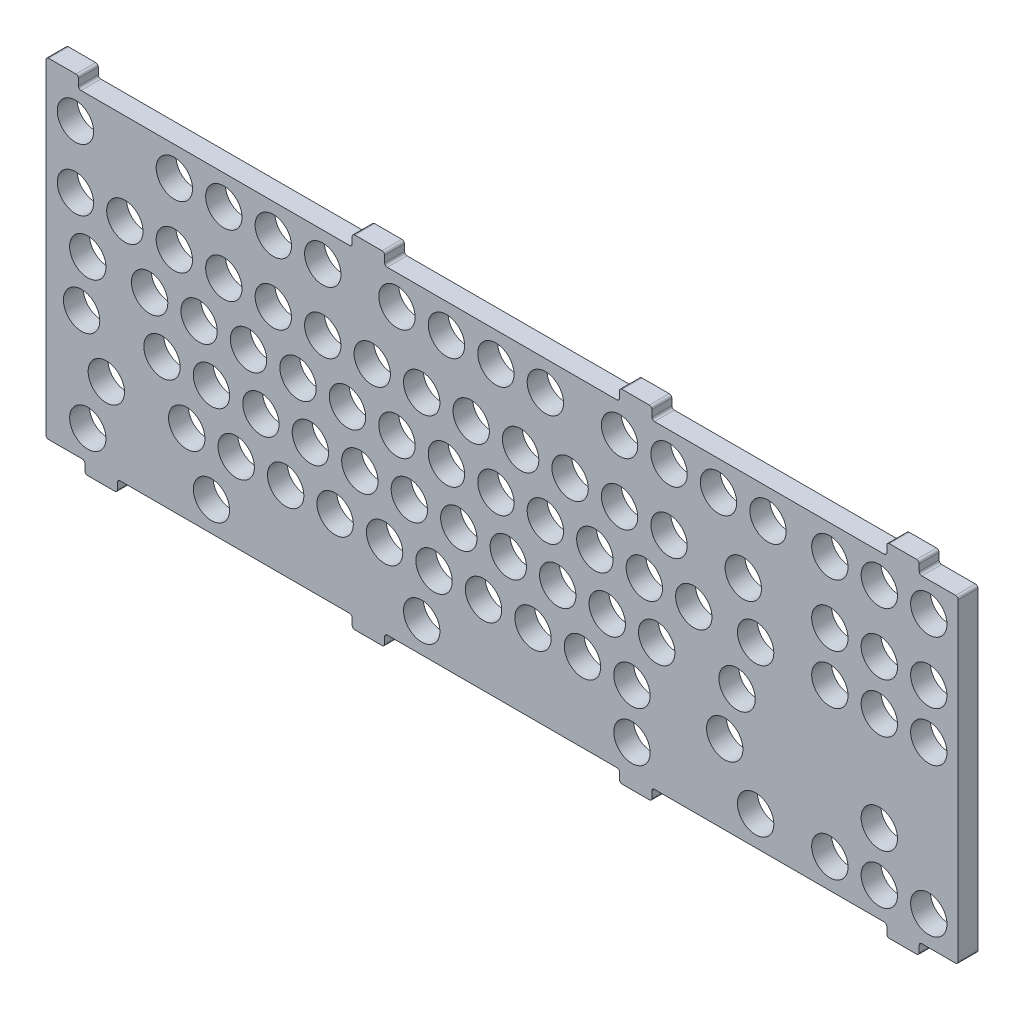
from build123d import *

# Parameters (mm, degrees)
BOSS_EXTRUDE1_DEPTH = 7.63


with BuildPart() as part:
    # Sketch1 → Boss-Extrude1 (new body)
    with BuildSketch(Plane.XY):
        with BuildLine():
            Line((-164.13125, 65.83125), (-174.63125, 65.83125))
            ThreePointArc((-174.63125, 65.83125), (-175.338356781, 65.538356781), (-175.63125, 64.83125))
            Line((-175.63125, 64.83125), (-175.63125, -60.33125))
            ThreePointArc((-175.63125, -60.33125), (-175.338356781, -61.038356781), (-174.63125, -61.33125))
            Line((-174.63125, -61.33125), (-161.631250002, -61.33125))
            ThreePointArc((-161.631250002, -61.33125), (-160.92414322, -61.624143219), (-160.631250002, -62.33125))
            Line((-160.631250002, -62.33125), (-160.631250002, -64.83125))
            ThreePointArc((-160.631250002, -64.83125), (-160.338356783, -65.538356781), (-159.631250002, -65.83125))
            Line((-159.631250002, -65.83125), (-149.131250002, -65.83125))
            ThreePointArc((-149.131250002, -65.83125), (-148.42414322, -65.538356781), (-148.131250002, -64.83125))
            Line((-148.131250002, -64.83125), (-148.131250002, -62.33125))
            ThreePointArc((-148.131250002, -62.33125), (-147.838356783, -61.624143219), (-147.131250002, -61.33125))
            Line((-147.131250002, -61.33125), (-58.710416668, -61.33125))
            ThreePointArc((-58.710416668, -61.33125), (-58.003309887, -61.624143219), (-57.710416668, -62.33125))
            Line((-57.710416668, -62.33125), (-57.710416668, -64.83125))
            ThreePointArc((-57.710416668, -64.83125), (-57.417523449, -65.538356781), (-56.710416668, -65.83125))
            Line((-56.710416668, -65.83125), (-46.210416668, -65.83125))
            ThreePointArc((-46.210416668, -65.83125), (-45.503309887, -65.538356781), (-45.210416668, -64.83125))
            Line((-45.210416668, -64.83125), (-45.210416668, -62.33125))
            ThreePointArc((-45.210416668, -62.33125), (-44.917523449, -61.624143219), (-44.210416668, -61.33125))
            Line((-44.210416668, -61.33125), (44.210416665, -61.33125))
            ThreePointArc((44.210416665, -61.33125), (44.917523446, -61.624143219), (45.210416665, -62.33125))
            Line((45.210416665, -62.33125), (45.210416665, -64.83125))
            ThreePointArc((45.210416665, -64.83125), (45.503309884, -65.538356781), (46.210416665, -65.83125))
            Line((46.210416665, -65.83125), (56.710416665, -65.83125))
            ThreePointArc((56.710416665, -65.83125), (57.417523446, -65.538356781), (57.710416665, -64.83125))
            Line((57.710416665, -64.83125), (57.710416665, -62.33125))
            ThreePointArc((57.710416665, -62.33125), (58.003309884, -61.624143219), (58.710416665, -61.33125))
            Line((58.710416665, -61.33125), (147.131249998, -61.33125))
            ThreePointArc((147.131249998, -61.33125), (147.83835678, -61.624143219), (148.131249998, -62.33125))
            Line((148.131249998, -62.33125), (148.131249998, -64.83125))
            ThreePointArc((148.131249998, -64.83125), (148.424143217, -65.538356781), (149.131249998, -65.83125))
            Line((149.131249998, -65.83125), (159.631249998, -65.83125))
            ThreePointArc((159.631249998, -65.83125), (160.33835678, -65.538356781), (160.631249998, -64.83125))
            Line((160.631249998, -64.83125), (160.631249998, -62.33125))
            ThreePointArc((160.631249998, -62.33125), (160.924143217, -61.624143219), (161.631249998, -61.33125))
            Line((161.631249998, -61.33125), (174.63125, -61.33125))
            ThreePointArc((174.63125, -61.33125), (175.338356781, -61.038356781), (175.63125, -60.33125))
            Line((175.63125, -60.33125), (175.63125, 60.33125))
            ThreePointArc((175.63125, 60.33125), (175.338356781, 61.038356781), (174.63125, 61.33125))
            Line((174.63125, 61.33125), (161.631249998, 61.33125))
            ThreePointArc((161.631249998, 61.33125), (160.924143217, 61.624143219), (160.631249998, 62.33125))
            Line((160.631249998, 62.33125), (160.631249998, 64.83125))
            ThreePointArc((160.631249998, 64.83125), (160.33835678, 65.538356781), (159.631249998, 65.83125))
            Line((159.631249998, 65.83125), (149.131249998, 65.83125))
            ThreePointArc((149.131249998, 65.83125), (148.424143217, 65.538356781), (148.131249998, 64.83125))
            Line((148.131249998, 64.83125), (148.131249998, 62.33125))
            ThreePointArc((148.131249998, 62.33125), (147.83835678, 61.624143219), (147.131249998, 61.33125))
            Line((147.131249998, 61.33125), (58.710416665, 61.33125))
            ThreePointArc((58.710416665, 61.33125), (58.003309884, 61.624143219), (57.710416665, 62.33125))
            Line((57.710416665, 62.33125), (57.710416665, 64.83125))
            ThreePointArc((57.710416665, 64.83125), (57.417523446, 65.538356781), (56.710416665, 65.83125))
            Line((56.710416665, 65.83125), (46.210416665, 65.83125))
            ThreePointArc((46.210416665, 65.83125), (45.503309884, 65.538356781), (45.210416665, 64.83125))
            Line((45.210416665, 64.83125), (45.210416665, 62.33125))
            ThreePointArc((45.210416665, 62.33125), (44.917523446, 61.624143219), (44.210416665, 61.33125))
            Line((44.210416665, 61.33125), (-44.210416668, 61.33125))
            ThreePointArc((-44.210416668, 61.33125), (-44.917523449, 61.624143219), (-45.210416668, 62.33125))
            Line((-45.210416668, 62.33125), (-45.210416668, 64.83125))
            ThreePointArc((-45.210416668, 64.83125), (-45.503309887, 65.538356781), (-46.210416668, 65.83125))
            Line((-46.210416668, 65.83125), (-56.710416668, 65.83125))
            ThreePointArc((-56.710416668, 65.83125), (-57.417523449, 65.538356781), (-57.710416668, 64.83125))
            Line((-57.710416668, 64.83125), (-57.710416668, 62.33125))
            ThreePointArc((-57.710416668, 62.33125), (-58.003309887, 61.624143219), (-58.710416668, 61.33125))
            Line((-58.710416668, 61.33125), (-162.13125, 61.33125))
            ThreePointArc((-162.13125, 61.33125), (-162.838356781, 61.624143219), (-163.13125, 62.33125))
            Line((-163.13125, 62.33125), (-163.13125, 64.83125))
            ThreePointArc((-163.13125, 64.83125), (-163.424143219, 65.538356781), (-164.13125, 65.83125))
        make_face()
        with BuildLine():
            ThreePointArc((11.906864998, -37.956179996), (18.907264998, -30.955779996), (11.906864998, -23.955379996))
            ThreePointArc((11.906864998, -23.955379996), (4.906464998, -30.955779996), (11.906864998, -37.956179996))
        make_face(mode=Mode.SUBTRACT)
        with BuildLine():
            ThreePointArc((50.006864998, -57.006159996), (57.007254998, -50.005769996), (50.006864998, -43.005379996))
            ThreePointArc((50.006864998, -43.005379996), (43.006474998, -50.005769996), (50.006864998, -57.006159996))
        make_face(mode=Mode.SUBTRACT)
        with BuildLine():
            ThreePointArc((40.481864998, -18.905979996), (47.482164998, -11.905679996), (40.481864998, -4.905379996))
            ThreePointArc((40.481864998, -4.905379996), (33.481564998, -11.905679996), (40.481864998, -18.905979996))
        make_face(mode=Mode.SUBTRACT)
        with BuildLine():
            ThreePointArc((2.381864998, -18.905979996), (9.382164998, -11.905679996), (2.381864998, -4.905379996))
            ThreePointArc((2.381864998, -4.905379996), (-4.618435002, -11.905679996), (2.381864998, -18.905979996))
        make_face(mode=Mode.SUBTRACT)
        with BuildLine():
            ThreePointArc((-35.719635002, -18.905979996), (-28.719335002, -11.905679996), (-35.719635002, -4.905379996))
            ThreePointArc((-35.719635002, -4.905379996), (-42.719935002, -11.905679996), (-35.719635002, -18.905979996))
        make_face(mode=Mode.SUBTRACT)
        with BuildLine():
            ThreePointArc((-45.243135002, -37.956179996), (-38.242735002, -30.955779996), (-45.243135002, -23.955379996))
            ThreePointArc((-45.243135002, -23.955379996), (-52.243535002, -30.955779996), (-45.243135002, -37.956179996))
        make_face(mode=Mode.SUBTRACT)
        with BuildLine():
            ThreePointArc((-54.769635002, -18.905979996), (-47.769335002, -11.905679996), (-54.769635002, -4.905379996))
            ThreePointArc((-54.769635002, -4.905379996), (-61.769935002, -11.905679996), (-54.769635002, -18.905979996))
        make_face(mode=Mode.SUBTRACT)
        with BuildLine():
            ThreePointArc((-64.294635002, -37.956179996), (-57.294235002, -30.955779996), (-64.294635002, -23.955379996))
            ThreePointArc((-64.294635002, -23.955379996), (-71.295035002, -30.955779996), (-64.294635002, -37.956179996))
        make_face(mode=Mode.SUBTRACT)
        with BuildLine():
            ThreePointArc((-102.393285002, -37.956179996), (-95.392885002, -30.955779996), (-102.393285002, -23.955379996))
            ThreePointArc((-102.393285002, -23.955379996), (-109.393685002, -30.955779996), (-102.393285002, -37.956179996))
        make_face(mode=Mode.SUBTRACT)
        with BuildLine():
            ThreePointArc((-111.919685002, -18.905979996), (-104.919385002, -11.905679996), (-111.919685002, -4.905379996))
            ThreePointArc((-111.919685002, -4.905379996), (-118.919985002, -11.905679996), (-111.919685002, -18.905979996))
        make_face(mode=Mode.SUBTRACT)
        with BuildLine():
            ThreePointArc((-121.443285002, -37.956179996), (-114.442885002, -30.955779996), (-121.443285002, -23.955379996))
            ThreePointArc((-121.443285002, -23.955379996), (-128.443685002, -30.955779996), (-121.443285002, -37.956179996))
        make_face(mode=Mode.SUBTRACT)
        with BuildLine():
            ThreePointArc((-159.543205002, -57.006159996), (-152.542815002, -50.005769996), (-159.543205002, -43.005379996))
            ThreePointArc((-159.543205002, -43.005379996), (-166.543595002, -50.005769996), (-159.543205002, -57.006159996))
        make_face(mode=Mode.SUBTRACT)
        with BuildLine():
            ThreePointArc((-161.925170002, -18.905979996), (-154.924870002, -11.905679996), (-161.925170002, -4.905379996))
            ThreePointArc((-161.925170002, -4.905379996), (-168.925470002, -11.905679996), (-161.925170002, -18.905979996))
        make_face(mode=Mode.SUBTRACT)
        with BuildLine():
            ThreePointArc((90.487864998, -18.905979996), (97.488164998, -11.905679996), (90.487864998, -4.905379996))
            ThreePointArc((90.487864998, -4.905379996), (83.487564998, -11.905679996), (90.487864998, -18.905979996))
        make_face(mode=Mode.SUBTRACT)
        with BuildLine():
            ThreePointArc((97.631864998, -57.006159996), (104.632254998, -50.005769996), (97.631864998, -43.005379996))
            ThreePointArc((97.631864998, -43.005379996), (90.631474998, -50.005769996), (97.631864998, -57.006159996))
        make_face(mode=Mode.SUBTRACT)
        with BuildLine():
            ThreePointArc((145.256864998, -37.956179996), (152.257264998, -30.955779996), (145.256864998, -23.955379996))
            ThreePointArc((145.256864998, -23.955379996), (138.256464998, -30.955779996), (145.256864998, -37.956179996))
        make_face(mode=Mode.SUBTRACT)
        with BuildLine():
            ThreePointArc((145.256864998, -57.006159996), (152.257254998, -50.005769996), (145.256864998, -43.005379996))
            ThreePointArc((145.256864998, -43.005379996), (138.256474998, -50.005769996), (145.256864998, -57.006159996))
        make_face(mode=Mode.SUBTRACT)
        with BuildLine():
            ThreePointArc((145.256864998, 0.144020004), (152.257164998, 7.144320004), (145.256864998, 14.144620004))
            ThreePointArc((145.256864998, 14.144620004), (138.256564998, 7.144320004), (145.256864998, 0.144020004))
        make_face(mode=Mode.SUBTRACT)
        with BuildLine():
            ThreePointArc((97.631864998, 0.144020004), (104.632164998, 7.144320004), (97.631864998, 14.144620004))
            ThreePointArc((97.631864998, 14.144620004), (90.631564998, 7.144320004), (97.631864998, 0.144020004))
        make_face(mode=Mode.SUBTRACT)
        with BuildLine():
            ThreePointArc((126.206864998, 19.194020004), (133.207164998, 26.194320004), (126.206864998, 33.194620004))
            ThreePointArc((126.206864998, 33.194620004), (119.206564998, 26.194320004), (126.206864998, 19.194020004))
        make_face(mode=Mode.SUBTRACT)
        with BuildLine():
            ThreePointArc((164.306864998, 19.194020004), (171.307164998, 26.194320004), (164.306864998, 33.194620004))
            ThreePointArc((164.306864998, 33.194620004), (157.306564998, 26.194320004), (164.306864998, 19.194020004))
        make_face(mode=Mode.SUBTRACT)
        with BuildLine():
            ThreePointArc((145.256864998, 43.006220004), (152.256864998, 50.006220004), (145.256864998, 57.006220004))
            ThreePointArc((145.256864998, 57.006220004), (138.256864998, 50.006220004), (145.256864998, 43.006220004))
        make_face(mode=Mode.SUBTRACT)
        with BuildLine():
            ThreePointArc((102.393364998, 43.006220004), (109.393364998, 50.006220004), (102.393364998, 57.006220004))
            ThreePointArc((102.393364998, 57.006220004), (95.393364998, 50.006220004), (102.393364998, 43.006220004))
        make_face(mode=Mode.SUBTRACT)
        with BuildLine():
            ThreePointArc((73.818364998, 0.144020004), (80.818664998, 7.144320004), (73.818364998, 14.144620004))
            ThreePointArc((73.818364998, 14.144620004), (66.818064998, 7.144320004), (73.818364998, 0.144020004))
        make_face(mode=Mode.SUBTRACT)
        with BuildLine():
            ThreePointArc((35.718364998, 0.131528429), (42.731156574, 7.144320004), (35.718364998, 14.157111579))
            ThreePointArc((35.718364998, 14.157111579), (28.705573423, 7.144320004), (35.718364998, 0.131528429))
        make_face(mode=Mode.SUBTRACT)
        with BuildLine():
            ThreePointArc((-2.381635002, 0.144020004), (4.618664998, 7.144320004), (-2.381635002, 14.144620004))
            ThreePointArc((-2.381635002, 14.144620004), (-9.381935002, 7.144320004), (-2.381635002, 0.144020004))
        make_face(mode=Mode.SUBTRACT)
        with BuildLine():
            ThreePointArc((26.193364998, 19.194020004), (33.193664998, 26.194320004), (26.193364998, 33.194620004))
            ThreePointArc((26.193364998, 33.194620004), (19.193064998, 26.194320004), (26.193364998, 19.194020004))
        make_face(mode=Mode.SUBTRACT)
        with BuildLine():
            ThreePointArc((64.293364998, 19.194020004), (71.293664998, 26.194320004), (64.293364998, 33.194620004))
            ThreePointArc((64.293364998, 33.194620004), (57.293064998, 26.194320004), (64.293364998, 19.194020004))
        make_face(mode=Mode.SUBTRACT)
        with BuildLine():
            ThreePointArc((45.243364998, 43.006220004), (52.243364998, 50.006220004), (45.243364998, 57.006220004))
            ThreePointArc((45.243364998, 57.006220004), (38.243364998, 50.006220004), (45.243364998, 43.006220004))
        make_face(mode=Mode.SUBTRACT)
        with BuildLine():
            ThreePointArc((-2.381635002, 43.006220004), (4.618364998, 50.006220004), (-2.381635002, 57.006220004))
            ThreePointArc((-2.381635002, 57.006220004), (-9.381635002, 50.006220004), (-2.381635002, 43.006220004))
        make_face(mode=Mode.SUBTRACT)
        with BuildLine():
            ThreePointArc((-159.543205002, 0.144020004), (-152.542905002, 7.144320004), (-159.543205002, 14.144620004))
            ThreePointArc((-159.543205002, 14.144620004), (-166.543505002, 7.144320004), (-159.543205002, 0.144020004))
        make_face(mode=Mode.SUBTRACT)
        with BuildLine():
            ThreePointArc((-21.431635002, 0.144020004), (-14.431335002, 7.144320004), (-21.431635002, 14.144620004))
            ThreePointArc((-21.431635002, 14.144620004), (-28.431935002, 7.144320004), (-21.431635002, 0.144020004))
        make_face(mode=Mode.SUBTRACT)
        with BuildLine():
            ThreePointArc((-59.531635002, 0.144020004), (-52.531335002, 7.144320004), (-59.531635002, 14.144620004))
            ThreePointArc((-59.531635002, 14.144620004), (-66.531935002, 7.144320004), (-59.531635002, 0.144020004))
        make_face(mode=Mode.SUBTRACT)
        with BuildLine():
            ThreePointArc((-97.631485002, 0.144020004), (-90.631185002, 7.144320004), (-97.631485002, 14.144620004))
            ThreePointArc((-97.631485002, 14.144620004), (-104.631785002, 7.144320004), (-97.631485002, 0.144020004))
        make_face(mode=Mode.SUBTRACT)
        with BuildLine():
            ThreePointArc((-135.731485002, 0.144020004), (-128.731185002, 7.144320004), (-135.731485002, 14.144620004))
            ThreePointArc((-135.731485002, 14.144620004), (-142.731785002, 7.144320004), (-135.731485002, 0.144020004))
        make_face(mode=Mode.SUBTRACT)
        with BuildLine():
            ThreePointArc((-50.006635002, 19.194020004), (-43.006335002, 26.194320004), (-50.006635002, 33.194620004))
            ThreePointArc((-50.006635002, 33.194620004), (-57.006935002, 26.194320004), (-50.006635002, 19.194020004))
        make_face(mode=Mode.SUBTRACT)
        with BuildLine():
            ThreePointArc((-88.106485002, 19.194020004), (-81.106185002, 26.194320004), (-88.106485002, 33.194620004))
            ThreePointArc((-88.106485002, 33.194620004), (-95.106785002, 26.194320004), (-88.106485002, 19.194020004))
        make_face(mode=Mode.SUBTRACT)
        with BuildLine():
            ThreePointArc((-126.206485002, 19.194020004), (-119.206185002, 26.194320004), (-126.206485002, 33.194620004))
            ThreePointArc((-126.206485002, 33.194620004), (-133.206785002, 26.194320004), (-126.206485002, 19.194020004))
        make_face(mode=Mode.SUBTRACT)
        with BuildLine():
            ThreePointArc((-21.431635002, 43.006220004), (-14.431635002, 50.006220004), (-21.431635002, 57.006220004))
            ThreePointArc((-21.431635002, 57.006220004), (-28.431635002, 50.006220004), (-21.431635002, 43.006220004))
        make_face(mode=Mode.SUBTRACT)
        with BuildLine():
            ThreePointArc((-69.056485002, 43.006220004), (-62.056485002, 50.006220004), (-69.056485002, 57.006220004))
            ThreePointArc((-69.056485002, 57.006220004), (-76.056485002, 50.006220004), (-69.056485002, 43.006220004))
        make_face(mode=Mode.SUBTRACT)
        with BuildLine():
            ThreePointArc((-107.156485002, 43.006220004), (-100.156485002, 50.006220004), (-107.156485002, 57.006220004))
            ThreePointArc((-107.156485002, 57.006220004), (-114.156485002, 50.006220004), (-107.156485002, 43.006220004))
        make_face(mode=Mode.SUBTRACT)
        with BuildLine():
            ThreePointArc((-164.306400002, 43.006220004), (-157.306400002, 50.006220004), (-164.306400002, 57.006220004))
            ThreePointArc((-164.306400002, 57.006220004), (-171.306400002, 50.006220004), (-164.306400002, 43.006220004))
        make_face(mode=Mode.SUBTRACT)
        with BuildLine():
            ThreePointArc((-126.206485002, 43.006220004), (-119.206485002, 50.006220004), (-126.206485002, 57.006220004))
            ThreePointArc((-126.206485002, 57.006220004), (-133.206485002, 50.006220004), (-126.206485002, 43.006220004))
        make_face(mode=Mode.SUBTRACT)
        with BuildLine():
            ThreePointArc((-88.106485002, 43.006220004), (-81.106485002, 50.006220004), (-88.106485002, 57.006220004))
            ThreePointArc((-88.106485002, 57.006220004), (-95.106485002, 50.006220004), (-88.106485002, 43.006220004))
        make_face(mode=Mode.SUBTRACT)
        with BuildLine():
            ThreePointArc((-40.481635002, 43.006220004), (-33.481635002, 50.006220004), (-40.481635002, 57.006220004))
            ThreePointArc((-40.481635002, 57.006220004), (-47.481635002, 50.006220004), (-40.481635002, 43.006220004))
        make_face(mode=Mode.SUBTRACT)
        with BuildLine():
            ThreePointArc((-145.256485002, 19.194020004), (-138.256185002, 26.194320004), (-145.256485002, 33.194620004))
            ThreePointArc((-145.256485002, 33.194620004), (-152.256785002, 26.194320004), (-145.256485002, 19.194020004))
        make_face(mode=Mode.SUBTRACT)
        with BuildLine():
            ThreePointArc((-107.156485002, 19.194020004), (-100.156185002, 26.194320004), (-107.156485002, 33.194620004))
            ThreePointArc((-107.156485002, 33.194620004), (-114.156785002, 26.194320004), (-107.156485002, 19.194020004))
        make_face(mode=Mode.SUBTRACT)
        with BuildLine():
            ThreePointArc((-69.056485002, 19.194020004), (-62.056185002, 26.194320004), (-69.056485002, 33.194620004))
            ThreePointArc((-69.056485002, 33.194620004), (-76.056785002, 26.194320004), (-69.056485002, 19.194020004))
        make_face(mode=Mode.SUBTRACT)
        with BuildLine():
            ThreePointArc((-30.956635002, 19.194020004), (-23.956335002, 26.194320004), (-30.956635002, 33.194620004))
            ThreePointArc((-30.956635002, 33.194620004), (-37.956935002, 26.194320004), (-30.956635002, 19.194020004))
        make_face(mode=Mode.SUBTRACT)
        with BuildLine():
            ThreePointArc((-116.681485002, 0.144020004), (-109.681185002, 7.144320004), (-116.681485002, 14.144620004))
            ThreePointArc((-116.681485002, 14.144620004), (-123.681785002, 7.144320004), (-116.681485002, 0.144020004))
        make_face(mode=Mode.SUBTRACT)
        with BuildLine():
            ThreePointArc((-78.581485002, 0.144020004), (-71.581185002, 7.144320004), (-78.581485002, 14.144620004))
            ThreePointArc((-78.581485002, 14.144620004), (-85.581785002, 7.144320004), (-78.581485002, 0.144020004))
        make_face(mode=Mode.SUBTRACT)
        with BuildLine():
            ThreePointArc((-40.481635002, 0.144020004), (-33.481335002, 7.144320004), (-40.481635002, 14.144620004))
            ThreePointArc((-40.481635002, 14.144620004), (-47.481935002, 7.144320004), (-40.481635002, 0.144020004))
        make_face(mode=Mode.SUBTRACT)
        with BuildLine():
            ThreePointArc((-164.306400002, 19.194020004), (-157.306100002, 26.194320004), (-164.306400002, 33.194620004))
            ThreePointArc((-164.306400002, 33.194620004), (-171.306700002, 26.194320004), (-164.306400002, 19.194020004))
        make_face(mode=Mode.SUBTRACT)
        with BuildLine():
            ThreePointArc((-11.906635002, 19.194020004), (-4.906335002, 26.194320004), (-11.906635002, 33.194620004))
            ThreePointArc((-11.906635002, 33.194620004), (-18.906935002, 26.194320004), (-11.906635002, 19.194020004))
        make_face(mode=Mode.SUBTRACT)
        with BuildLine():
            ThreePointArc((16.668364998, 43.006220004), (23.668364998, 50.006220004), (16.668364998, 57.006220004))
            ThreePointArc((16.668364998, 57.006220004), (9.668364998, 50.006220004), (16.668364998, 43.006220004))
        make_face(mode=Mode.SUBTRACT)
        with BuildLine():
            ThreePointArc((64.293364998, 43.006220004), (71.293364998, 50.006220004), (64.293364998, 57.006220004))
            ThreePointArc((64.293364998, 57.006220004), (57.293364998, 50.006220004), (64.293364998, 43.006220004))
        make_face(mode=Mode.SUBTRACT)
        with BuildLine():
            ThreePointArc((45.243364998, 19.194020004), (52.243664998, 26.194320004), (45.243364998, 33.194620004))
            ThreePointArc((45.243364998, 33.194620004), (38.243064998, 26.194320004), (45.243364998, 19.194020004))
        make_face(mode=Mode.SUBTRACT)
        with BuildLine():
            ThreePointArc((7.143364998, 19.194020004), (14.143664998, 26.194320004), (7.143364998, 33.194620004))
            ThreePointArc((7.143364998, 33.194620004), (0.143064998, 26.194320004), (7.143364998, 19.194020004))
        make_face(mode=Mode.SUBTRACT)
        with BuildLine():
            ThreePointArc((16.668364998, 0.144020004), (23.668664998, 7.144320004), (16.668364998, 14.144620004))
            ThreePointArc((16.668364998, 14.144620004), (9.668064998, 7.144320004), (16.668364998, 0.144020004))
        make_face(mode=Mode.SUBTRACT)
        with BuildLine():
            ThreePointArc((54.768364998, 0.144020004), (61.768664998, 7.144320004), (54.768364998, 14.144620004))
            ThreePointArc((54.768364998, 14.144620004), (47.768064998, 7.144320004), (54.768364998, 0.144020004))
        make_face(mode=Mode.SUBTRACT)
        with BuildLine():
            ThreePointArc((83.343364998, 43.006220004), (90.343364998, 50.006220004), (83.343364998, 57.006220004))
            ThreePointArc((83.343364998, 57.006220004), (76.343364998, 50.006220004), (83.343364998, 43.006220004))
        make_face(mode=Mode.SUBTRACT)
        with BuildLine():
            ThreePointArc((126.206864998, 43.006220004), (133.206864998, 50.006220004), (126.206864998, 57.006220004))
            ThreePointArc((126.206864998, 57.006220004), (119.206864998, 50.006220004), (126.206864998, 43.006220004))
        make_face(mode=Mode.SUBTRACT)
        with BuildLine():
            ThreePointArc((164.306864998, 43.006220004), (171.306864998, 50.006220004), (164.306864998, 57.006220004))
            ThreePointArc((164.306864998, 57.006220004), (157.306864998, 50.006220004), (164.306864998, 43.006220004))
        make_face(mode=Mode.SUBTRACT)
        with BuildLine():
            ThreePointArc((145.256864998, 19.194020004), (152.257164998, 26.194320004), (145.256864998, 33.194620004))
            ThreePointArc((145.256864998, 33.194620004), (138.256564998, 26.194320004), (145.256864998, 19.194020004))
        make_face(mode=Mode.SUBTRACT)
        with BuildLine():
            ThreePointArc((92.868364998, 19.194020004), (99.868664998, 26.194320004), (92.868364998, 33.194620004))
            ThreePointArc((92.868364998, 33.194620004), (85.868064998, 26.194320004), (92.868364998, 19.194020004))
        make_face(mode=Mode.SUBTRACT)
        with BuildLine():
            ThreePointArc((126.206864998, 0.144020004), (133.207164998, 7.144320004), (126.206864998, 14.144620004))
            ThreePointArc((126.206864998, 14.144620004), (119.206564998, 7.144320004), (126.206864998, 0.144020004))
        make_face(mode=Mode.SUBTRACT)
        with BuildLine():
            ThreePointArc((164.306864998, 0.144020004), (171.307164998, 7.144320004), (164.306864998, 14.144620004))
            ThreePointArc((164.306864998, 14.144620004), (157.306564998, 7.144320004), (164.306864998, 0.144020004))
        make_face(mode=Mode.SUBTRACT)
        with BuildLine():
            ThreePointArc((126.206864998, -57.006159996), (133.207254998, -50.005769996), (126.206864998, -43.005379996))
            ThreePointArc((126.206864998, -43.005379996), (119.206474998, -50.005769996), (126.206864998, -57.006159996))
        make_face(mode=Mode.SUBTRACT)
        with BuildLine():
            ThreePointArc((164.306864998, -57.006159996), (171.307254998, -50.005769996), (164.306864998, -43.005379996))
            ThreePointArc((164.306864998, -43.005379996), (157.306474998, -50.005769996), (164.306864998, -57.006159996))
        make_face(mode=Mode.SUBTRACT)
        with BuildLine():
            ThreePointArc((85.724864998, -37.956179996), (92.725264998, -30.955779996), (85.724864998, -23.955379996))
            ThreePointArc((85.724864998, -23.955379996), (78.724464998, -30.955779996), (85.724864998, -37.956179996))
        make_face(mode=Mode.SUBTRACT)
        with BuildLine():
            ThreePointArc((59.531864998, -18.905979996), (66.532164998, -11.905679996), (59.531864998, -4.905379996))
            ThreePointArc((59.531864998, -4.905379996), (52.531564998, -11.905679996), (59.531864998, -18.905979996))
        make_face(mode=Mode.SUBTRACT)
        with BuildLine():
            ThreePointArc((-130.969685002, -18.905979996), (-123.969385002, -11.905679996), (-130.969685002, -4.905379996))
            ThreePointArc((-130.969685002, -4.905379996), (-137.969985002, -11.905679996), (-130.969685002, -18.905979996))
        make_face(mode=Mode.SUBTRACT)
        with BuildLine():
            ThreePointArc((-152.400185002, -37.956179996), (-145.399785002, -30.955779996), (-152.400185002, -23.955379996))
            ThreePointArc((-152.400185002, -23.955379996), (-159.400585002, -30.955779996), (-152.400185002, -37.956179996))
        make_face(mode=Mode.SUBTRACT)
        with BuildLine():
            ThreePointArc((-111.918285002, -57.006159996), (-104.917895002, -50.005769996), (-111.918285002, -43.005379996))
            ThreePointArc((-111.918285002, -43.005379996), (-118.918675002, -50.005769996), (-111.918285002, -57.006159996))
        make_face(mode=Mode.SUBTRACT)
        with BuildLine():
            ThreePointArc((-92.869685002, -18.905979996), (-85.869385002, -11.905679996), (-92.869685002, -4.905379996))
            ThreePointArc((-92.869685002, -4.905379996), (-99.869985002, -11.905679996), (-92.869685002, -18.905979996))
        make_face(mode=Mode.SUBTRACT)
        with BuildLine():
            ThreePointArc((-83.344685002, -37.956179996), (-76.344285002, -30.955779996), (-83.344685002, -23.955379996))
            ThreePointArc((-83.344685002, -23.955379996), (-90.345085002, -30.955779996), (-83.344685002, -37.956179996))
        make_face(mode=Mode.SUBTRACT)
        with BuildLine():
            ThreePointArc((-73.819735002, -18.905979996), (-66.819435002, -11.905679996), (-73.819735002, -4.905379996))
            ThreePointArc((-73.819735002, -4.905379996), (-80.820035002, -11.905679996), (-73.819735002, -18.905979996))
        make_face(mode=Mode.SUBTRACT)
        with BuildLine():
            ThreePointArc((-30.956635002, -57.006159996), (-23.956245002, -50.005769996), (-30.956635002, -43.005379996))
            ThreePointArc((-30.956635002, -43.005379996), (-37.957025002, -50.005769996), (-30.956635002, -57.006159996))
        make_face(mode=Mode.SUBTRACT)
        with BuildLine():
            ThreePointArc((-26.193135002, -37.956179996), (-19.192735002, -30.955779996), (-26.193135002, -23.955379996))
            ThreePointArc((-26.193135002, -23.955379996), (-33.193535002, -30.955779996), (-26.193135002, -37.956179996))
        make_face(mode=Mode.SUBTRACT)
        with BuildLine():
            ThreePointArc((-16.669635002, -18.905979996), (-9.669335002, -11.905679996), (-16.669635002, -4.905379996))
            ThreePointArc((-16.669635002, -4.905379996), (-23.669935002, -11.905679996), (-16.669635002, -18.905979996))
        make_face(mode=Mode.SUBTRACT)
        with BuildLine():
            ThreePointArc((21.431864998, -18.905979996), (28.432164998, -11.905679996), (21.431864998, -4.905379996))
            ThreePointArc((21.431864998, -4.905379996), (14.431564998, -11.905679996), (21.431864998, -18.905979996))
        make_face(mode=Mode.SUBTRACT)
        with BuildLine():
            ThreePointArc((50.006864998, -37.956179996), (57.007264998, -30.955779996), (50.006864998, -23.955379996))
            ThreePointArc((50.006864998, -23.955379996), (43.006464998, -30.955779996), (50.006864998, -37.956179996))
        make_face(mode=Mode.SUBTRACT)
        with BuildLine():
            ThreePointArc((30.956864998, -37.956179996), (37.957264998, -30.955779996), (30.956864998, -23.955379996))
            ThreePointArc((30.956864998, -23.955379996), (23.956464998, -30.955779996), (30.956864998, -37.956179996))
        make_face(mode=Mode.SUBTRACT)
        with BuildLine():
            ThreePointArc((-7.143135002, -37.956179996), (-0.142735002, -30.955779996), (-7.143135002, -23.955379996))
            ThreePointArc((-7.143135002, -23.955379996), (-14.143535002, -30.955779996), (-7.143135002, -37.956179996))
        make_face(mode=Mode.SUBTRACT)
    extrude(amount=BOSS_EXTRUDE1_DEPTH)


solid = part.part
